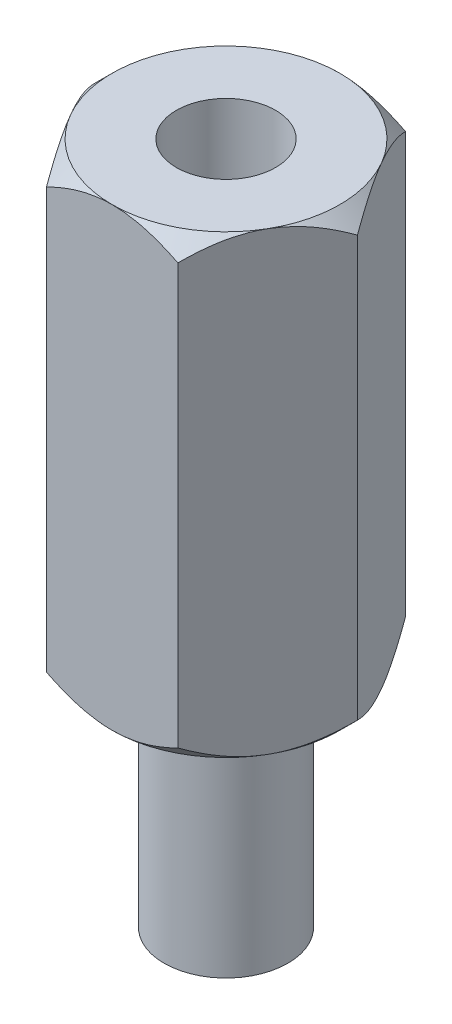
from build123d import *

# Parameters (mm, degrees)
BOSS_EXTRUDE1_DEPTH = 12.7
SKETCH5_R           = 1.3843
CUT_EXTRUDE1_DEPTH  = 6.35
SKETCH6_R           = 1.7272
BOSS_EXTRUDE2_DEPTH = 6.35


with BuildPart() as part:
    # Sketch1 → Boss-Extrude1 (new body)
    with BuildSketch(Plane(origin=(0, 0, 0), x_dir=(1, 0, 0), z_dir=(0, 1, 0))):
        Polygon((3.666174209, 0), (1.833087105, 3.175), (-1.833087105, 3.175), (-3.666174209, 0), (-1.833087105, -3.175), (1.833087105, -3.175), align=None)
    extrude(amount=BOSS_EXTRUDE1_DEPTH)

    # Sketch2 → Cut-Revolve1 (revolve, cut)
    with BuildSketch(Plane.XY):
        Polygon((-3.666174209, 0.491174209), (-3.175, 0), (-3.666174209, 0), align=None)
        Polygon((-3.666174209, 12.7), (-3.666174209, 12.208825791), (-3.175, 12.7), align=None)
    revolve(axis=Axis((0, 0, 0), (0, 1, 0)), mode=Mode.SUBTRACT)

    # Sketch5 → Cut-Extrude1 (cut)
    with BuildSketch(Plane(origin=(0, 12.7, 0), x_dir=(1, 0, 0), z_dir=(0, 1, 0))):
        with Locations(Location((0, 0, 0), (0, 0, 270))):
            Circle(SKETCH5_R)
    extrude(amount=-CUT_EXTRUDE1_DEPTH, mode=Mode.SUBTRACT)

    # Sketch6 → Boss-Extrude2 (add)
    with BuildSketch(Plane.XZ):
        with Locations(Location((0, 0, 0), (0, 0, 90))):
            Circle(SKETCH6_R)
    extrude(amount=BOSS_EXTRUDE2_DEPTH)


solid = part.part
